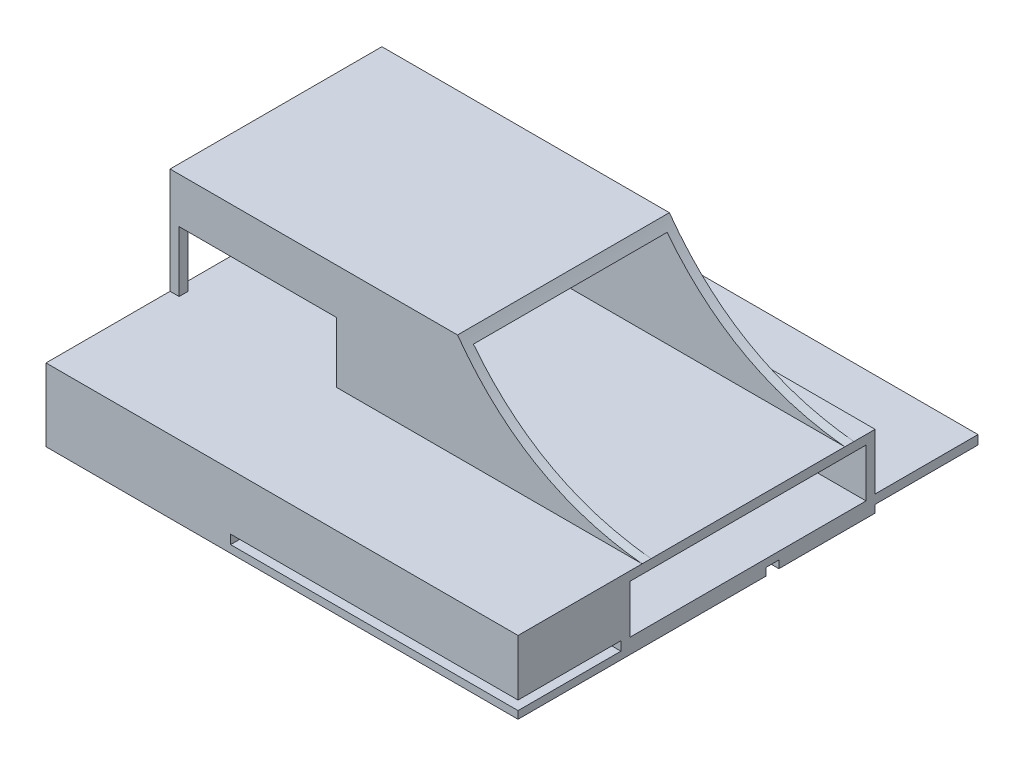
from build123d import *

# Parameters (mm, degrees)
ESQUISSE1_W             = 156
ESQUISSE1_H             = 84
BOSS_EXTRU_1_DEPTH      = 59
ESQUISSE2_W             = 78
ESQUISSE2_H             = 16
ESQUISSE2_W_2           = 7
ESQUISSE2_H_2           = 35
ESQUISSE2_W_3           = 4.2
ESQUISSE2_H_3           = 2.5
ENL_V_MAT_EXTRU_1_DEPTH = 177.572550515
ENL_V_MAT_EXTRU_3_DEPTH = 141.546285889
ESQUISSE4_W             = 52
ESQUISSE4_H             = 20
ENL_V_MAT_EXTRU_4_DEPTH = 59
BOSS_EXTRU_2_DEPTH      = 34
BOSS_EXTRU_3_DEPTH      = 34


with BuildPart() as part:
    # Esquisse1 → Boss.-Extru.1 (new body)
    with BuildSketch(Plane(origin=(0, 0, 0), x_dir=(1, 0, 0), z_dir=(0, 1, 0))):
        with Locations((23.701811573, 15.972972973)):
            Rectangle(ESQUISSE1_W, ESQUISSE1_H)
    extrude(amount=BOSS_EXTRU_1_DEPTH)

    # Esquisse2 → Enlèv. mat.-Extru.1 (cut, through all)
    with BuildSketch(Plane(origin=(101.701811573, 0, 0), x_dir=(0, 0, -1), z_dir=(1, 0, 0))):
        Polygon((15.972972973, 24), (47.972972973, 24), (47.972972973, 56), (-16.027027027, 56), (-16.027027027, 24), align=None)
        with Locations((15.972972973, 13)):
            Rectangle(ESQUISSE2_W, ESQUISSE2_H)
        with Locations((-22.527027027, 41.5)):
            Rectangle(ESQUISSE2_W_2, ESQUISSE2_H_2)
        Polygon((54.972972973, 24), (57.972972973, 24), (57.972972973, 59), (50.972972973, 59), (50.972972973, 24), align=None)
        with Locations((24.072972973, 1.25)):
            Rectangle(ESQUISSE2_W_3, ESQUISSE2_H_3)
    extrude(amount=-ENL_V_MAT_EXTRU_1_DEPTH, mode=Mode.SUBTRACT)

    # Esquisse3 → Enlèv. mat.-Extru.3 (cut, through all)
    with BuildSketch(Plane.XY.offset(19.027027027)):
        with BuildLine():
            Line((101.701811573, 59), (40.701811573, 59))
            add(Edge.make_bspline(
                [(40.701811573, 59), (63.23269898, 27.796698054), (101.701811573, 24)],
                knots=[0, 0, 0, 1, 1, 1], degree=2))
            Line((101.701811573, 24), (101.701811573, 59))
        make_face()
    extrude(amount=-ENL_V_MAT_EXTRU_3_DEPTH, mode=Mode.SUBTRACT)

    # Esquisse4 → Enlèv. mat.-Extru.4 (cut)
    with BuildSketch(Plane.XY.offset(19.027027027)):
        with Locations((-25.298188427, 34)):
            Rectangle(ESQUISSE4_W, ESQUISSE4_H)
    extrude(amount=-ENL_V_MAT_EXTRU_4_DEPTH, mode=Mode.SUBTRACT)

    # Esquisse5 → Boss.-Extru.2 (add)
    with BuildSketch(Plane(origin=(0, 0, -57.972972973), x_dir=(-1, 0, 0), z_dir=(0, 0, -1))):
        Polygon((-101.701811573, 2.5), (-40.701811573, 2.75), (-40.701811573, 5.5), (-101.701811573, 5.5), align=None)
        Polygon((-40.701811573, 2.75), (-6.701811573, 2.660526316), (-6.701811573, 5.5), (-40.701811573, 5.5), align=None)
    extrude(amount=BOSS_EXTRU_2_DEPTH)

    # Esquisse6 → Boss.-Extru.3 (add)
    with BuildSketch(Plane.XY.offset(26.027027027)):
        Polygon((-54.298188427, 2.5), (-54.298188427, 0), (101.701811573, 0), (101.701811573, 2.5), (6.701811573, 2.5), (6.701811573, 5.5), (101.701811573, 5.5), (101.701811573, 24), (-54.298188427, 24), (-54.298188427, 5.5), align=None)
    extrude(amount=BOSS_EXTRU_3_DEPTH)


solid = part.part
